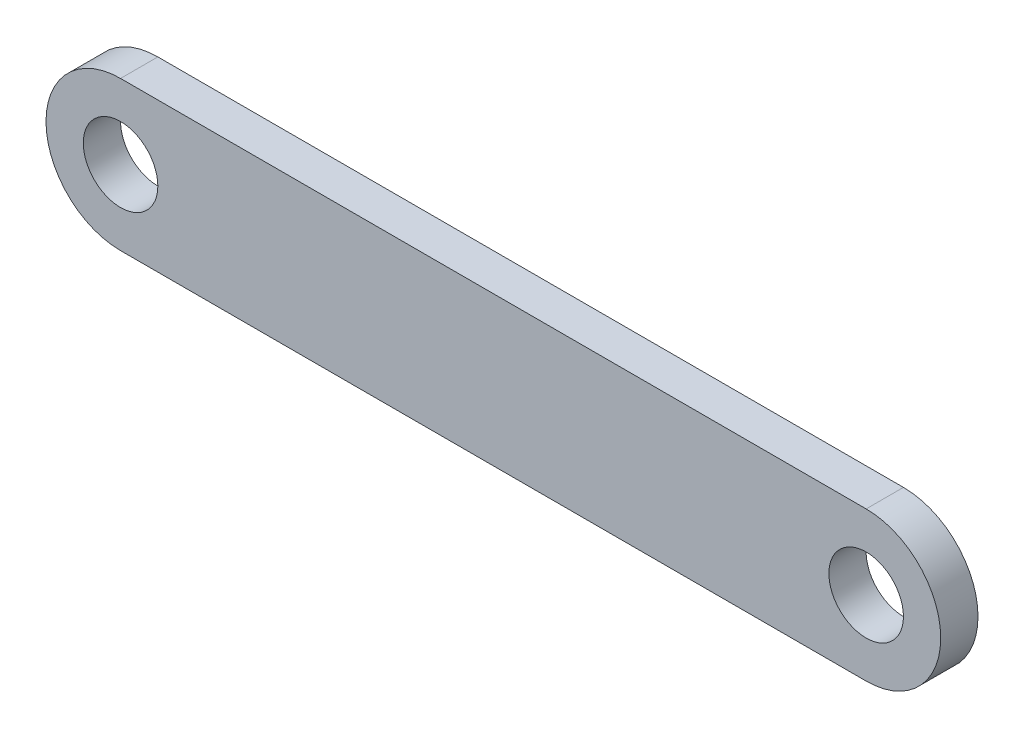
from build123d import *

# Parameters (mm, degrees)
CROQUIS1_R              = 5
SALIENTE_EXTRUIR1_DEPTH = 5


with BuildPart() as part:
    # Croquis1 → Saliente-Extruir1 (new body)
    with BuildSketch(Plane.XY):
        with BuildLine():
            Line((-50, 10), (50, 10))
            ThreePointArc((50, 10), (60, 0), (50, -10))
            Line((50, -10), (-50, -10))
            ThreePointArc((-50, -10), (-60, 0), (-50, 10))
        make_face()
        with Locations((-50, 0)):
            Circle(CROQUIS1_R, mode=Mode.SUBTRACT)
        with Locations((50, 0)):
            Circle(CROQUIS1_R, mode=Mode.SUBTRACT)
    extrude(amount=SALIENTE_EXTRUIR1_DEPTH)


solid = part.part
